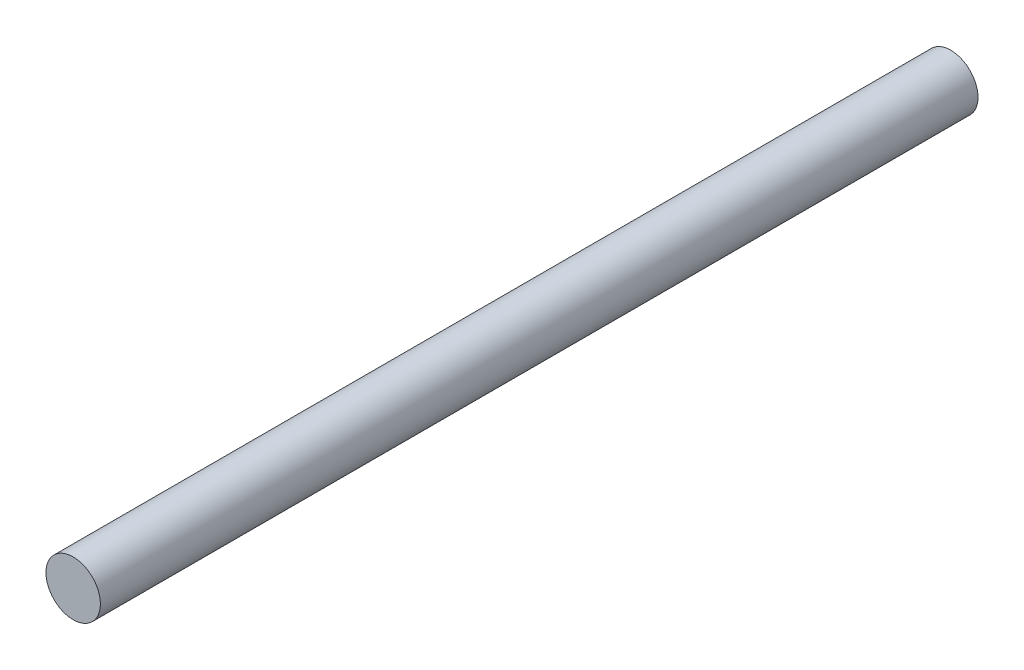
from build123d import *

# Parameters (mm, degrees)
S01_STEEL_ROD_AND_NOMINAL_THREADED_END_R       = 1.5
F_01_STEEL_ROD_AND_NOMINAL_THREADED_ENDS_DEPTH = 48.364941753


with BuildPart() as part:
    # S01 - Steel rod and nominal threaded ends → 01 - Steel rod and nominal threaded ends (new body)
    with BuildSketch(Plane.XY):
        Circle(S01_STEEL_ROD_AND_NOMINAL_THREADED_END_R)
    extrude(amount=F_01_STEEL_ROD_AND_NOMINAL_THREADED_ENDS_DEPTH)


solid = part.part
